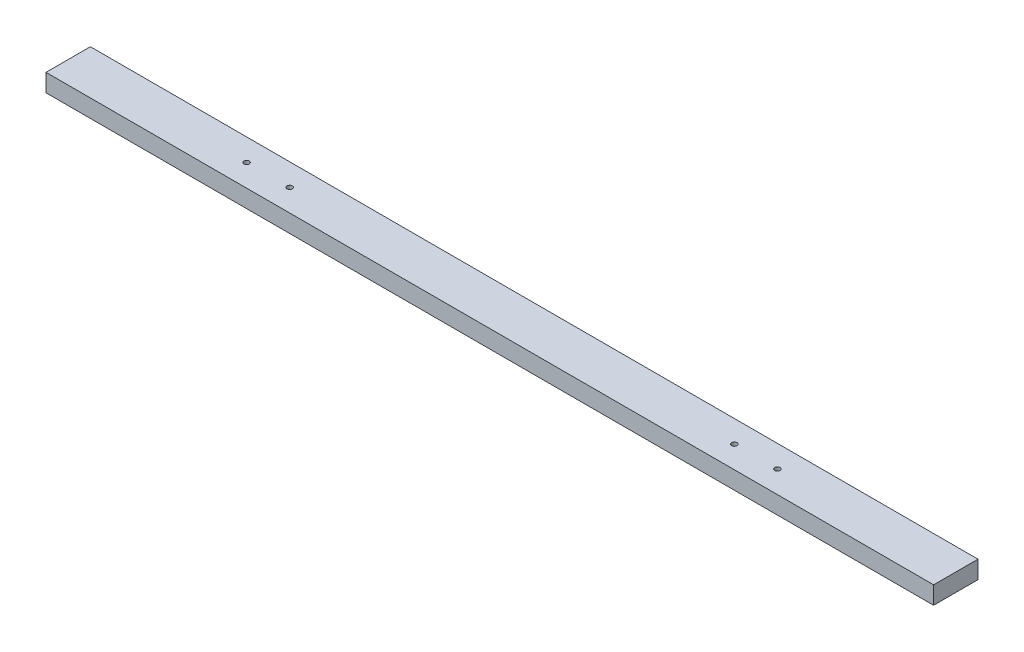
from build123d import *

# Parameters (mm, degrees)
SKETCH_1_W      = 1000
SKETCH_1_H      = 50
SKETCH_1_R      = 3
EXTRUDE_1_DEPTH = 20


with BuildPart() as part:
    # 草图1 → 凸台-拉伸1 (new body)
    with BuildSketch(Plane(origin=(0, 0, 0), x_dir=(1, 0, 0), z_dir=(0, 1, 0))):
        with Locations((500, 25)):
            Rectangle(SKETCH_1_W, SKETCH_1_H)
        with Locations(Location((799, 25, 0), (0, 0, 270))):
            Circle(SKETCH_1_R, mode=Mode.SUBTRACT)
        with Locations(Location((750.5, 25, 0), (0, 0, 270))):
            Circle(SKETCH_1_R, mode=Mode.SUBTRACT)
        with Locations(Location((201, 25, 0), (0, 0, 90))):
            Circle(SKETCH_1_R, mode=Mode.SUBTRACT)
        with Locations(Location((249.5, 25, 0), (0, 0, 90))):
            Circle(SKETCH_1_R, mode=Mode.SUBTRACT)
    extrude(amount=EXTRUDE_1_DEPTH)


solid = part.part
